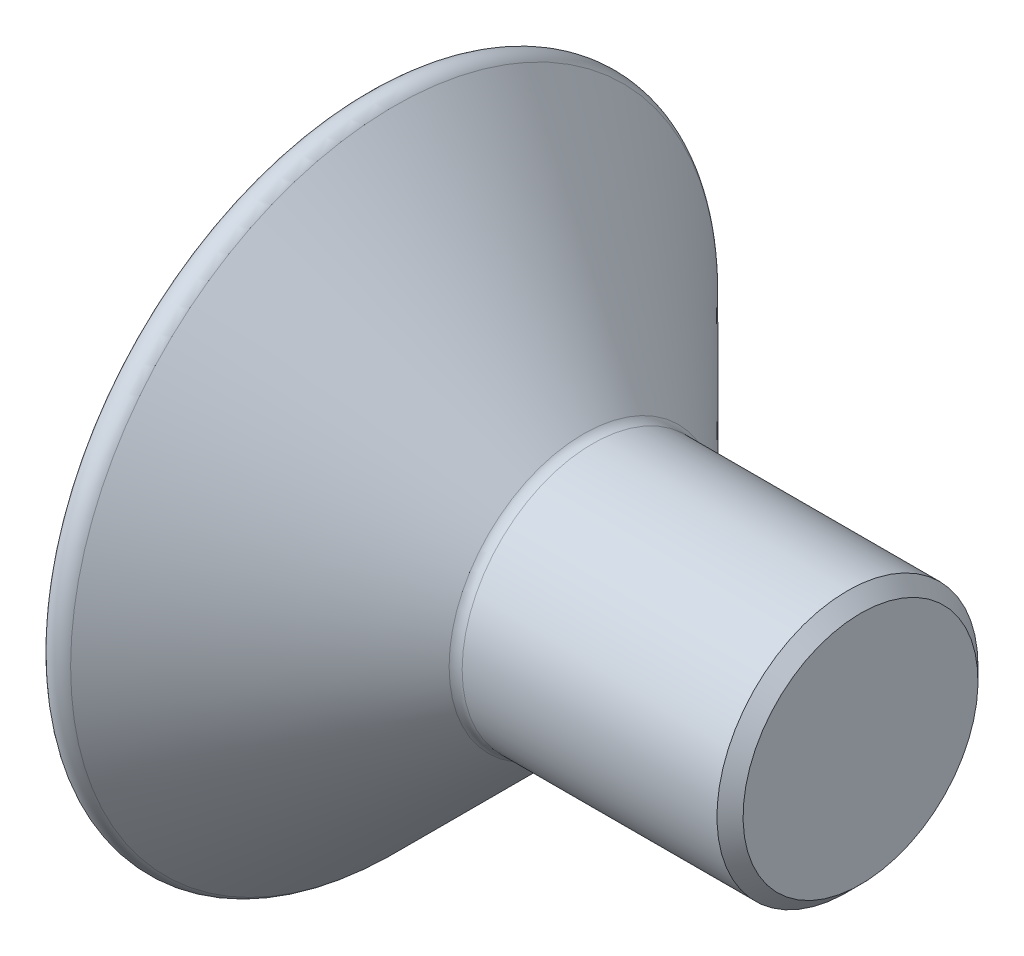
from build123d import *

# Parameters (mm, degrees)
HEXAGONSOCKET_DEPTH = 1.1
CHAMFER_2_SIZE      = 0.2705
SKETCH_1_R          = 3.36
EXTRUDE_4_DEPTH     = 0.5
EXTRUDE_START       = 0.15
SKETCH_8_R          = 3.36
EXTRUDE_6_DEPTH     = 0.15
FILLET_5_R          = 0.2
CUT_EXTRUDE_START   = 3.14
SKETCH_6_R          = 1.5
CUT_EXTRUDE_1_DEPTH = 5.628101593
FILLET_6_R          = 0.15
CHAMFER_1_SIZE      = 0.15


with BuildPart() as part:
    # Sketch1 → Base (revolve)
    with BuildSketch(Plane.XY, mode=Mode.PRIVATE) as base_sk:
        Polygon((0, 0), (0, 3.36), (1.86, 1.5), (8, 1.5), (8, 0), align=None)
    revolve(base_sk.sketch.rotate(Axis((-0.587069181, 0, 0), (1, 0, 0)), 90), axis=Axis((-0.587069181, 0, 0), (1, 0, 0)))

    # Sketch2 → HexagonSocket (cut)
    with BuildSketch(Plane(origin=(0, 0, 0), x_dir=(0, 0, -1), z_dir=(1, 0, 0))):
        Polygon((1.154700538, 0), (0.577350269, 1), (-0.577350269, 1), (-1.154700538, 0), (-0.577350269, -1), (0.577350269, -1), align=None)
    extrude(amount=HEXAGONSOCKET_DEPTH, mode=Mode.SUBTRACT)

    # Sketch3 → Cut-Revolve1 (revolve, cut)
    with BuildSketch(Plane.XY, mode=Mode.PRIVATE) as cut_revolve1_sk:
        Polygon((1.1, 1), (1.677350269, 0), (1.1, 0), align=None)
    revolve(cut_revolve1_sk.sketch.rotate(Axis((-0.439109555, 0, 0), (1, 0, 0)), 90), axis=Axis((-0.439109555, 0, 0), (1, 0, 0)), mode=Mode.SUBTRACT)

    # Chamfer 2
    chamfer_2_edges = [part.edges().sort_by_distance(p)[0] for p in [
        (8, 0, -1.5),
    ]]
    chamfer(chamfer_2_edges, length=CHAMFER_2_SIZE)

    # 草图1 → 凸台-拉伸4 (add)
    with BuildSketch(Plane.ZY):
        Circle(SKETCH_1_R)
        Polygon((0.577350269, -1), (-0.577350269, -1), (-1.154700538, 0), (-0.577350269, 1), (0.577350269, 1), (1.154700538, 0), align=None, mode=Mode.SUBTRACT)
    extrude(amount=-EXTRUDE_4_DEPTH)

    # 草图5 → 旋转7 (revolve)
    with BuildSketch(Plane(origin=(0, 0, 0), x_dir=(1, 0, 0), z_dir=(0, 0.5000000000000003, 0.8660254037844386)), mode=Mode.PRIVATE) as revolve_7_sk:
        Polygon((2.632985321, -0.645763152), (0.5, -2.778748473), (0.5, -3.36), (2.632985321, -1.227014679), align=None)
    revolve(revolve_7_sk.sketch.rotate(Axis((1.86, 0, 0), (-1, 0, 0)), 60), axis=Axis((1.86, 0, 0), (-1, 0, 0)))

    # 草图8 → 凸台-拉伸6 (add)
    with BuildSketch(Plane.ZY.offset(EXTRUDE_START)):
        Circle(SKETCH_8_R)
        Polygon((0.577350269, -1), (-0.577350269, -1), (-1.154700538, 0), (-0.577350269, 1), (0.577350269, 1), (1.154700538, 0), align=None, mode=Mode.SUBTRACT)
    extrude(amount=-EXTRUDE_6_DEPTH)

    # 草图11 → 旋转8 (revolve)
    with BuildSketch(Plane(origin=(0, 0, 0), x_dir=(1, 0, 0), z_dir=(0, 0.5000000000000003, 0.8660254037844386)), mode=Mode.PRIVATE) as revolve_8_sk:
        Polygon((0.5, -3.36), (0.217401845, -3.642598155), (0, -3.86), (-0.15, -3.71), (-0.15, -3.36), align=None)
    revolve(revolve_8_sk.sketch.rotate(Axis((-0.15, 0, 0), (1, 0, 0)), 300), axis=Axis((-0.15, 0, 0), (1, 0, 0)))

    # 圆角5
    fillet_5_edges = [part.edges().sort_by_distance(p)[0] for p in [
        (0, 0, -3.86),
    ]]
    fillet(fillet_5_edges, radius=FILLET_5_R)

    # 草图6 → 切除-拉伸1 (cut, through all)
    with BuildSketch(Plane(origin=(2.36, 0, 0), x_dir=(0, 0, -1), z_dir=(1, 0, 0)).offset(CUT_EXTRUDE_START)):
        with Locations(Location((0, 0, 0), (0, 0, 180))):
            Circle(SKETCH_6_R)
    extrude(amount=CUT_EXTRUDE_1_DEPTH, mode=Mode.SUBTRACT)

    # 圆角6
    fillet_6_edges = [part.edges().sort_by_distance(p)[0] for p in [
        (2.36, 0, -1.5),
    ]]
    fillet(fillet_6_edges, radius=FILLET_6_R)

    # 倒角1
    chamfer_1_edges = [part.edges().sort_by_distance(p)[0] for p in [
        (5.5, 0, -1.5),
    ]]
    chamfer(chamfer_1_edges, length=CHAMFER_1_SIZE)


solid = part.part
